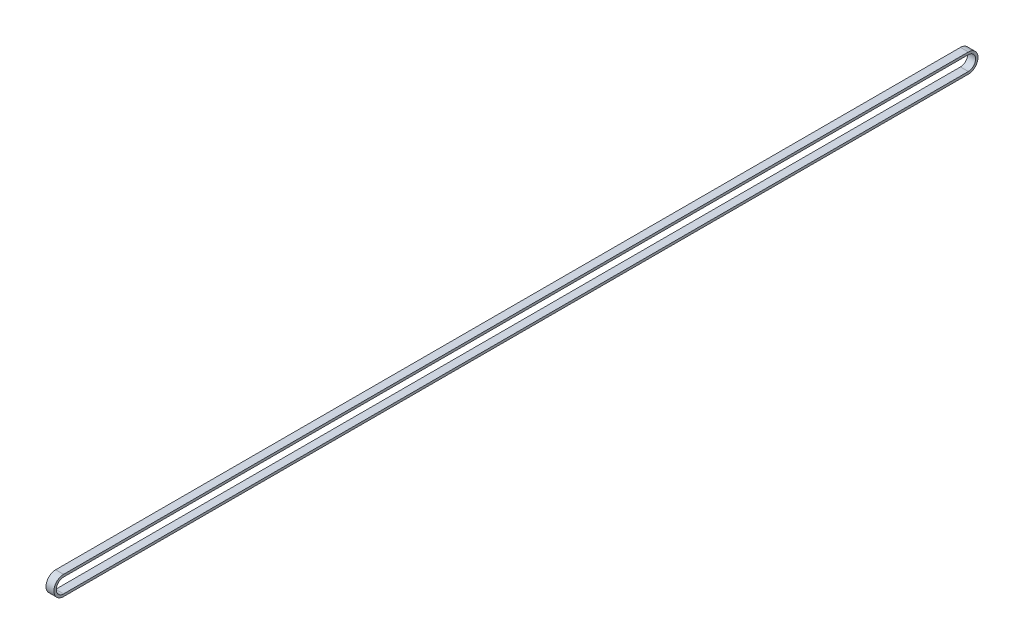
from build123d import *

# Parameters (mm, degrees)
EXTRUDE_1_DEPTH = 10


with BuildPart() as part:
    # 草图1 → 凸台-拉伸1 (new body)
    with BuildSketch(Plane(origin=(0, 0, 0), x_dir=(0, 0, -1), z_dir=(1, 0, 0))):
        with BuildLine():
            Line((0, 21.34), (1141, 21.34))
            ThreePointArc((1141, 21.34), (1153.17, 9.17), (1141, -3))
            Line((1141, -3), (0, -3))
            ThreePointArc((0, -3), (-12.17, 9.17), (0, 21.34))
        make_face()
        with BuildLine():
            Line((0, 0), (1141, 0))
            ThreePointArc((1141, 0), (1150.17, 9.17), (1141, 18.34))
            Line((1141, 18.34), (0, 18.34))
            ThreePointArc((0, 18.34), (-9.17, 9.17), (0, 0))
        make_face(mode=Mode.SUBTRACT)
    extrude(amount=EXTRUDE_1_DEPTH)


solid = part.part
